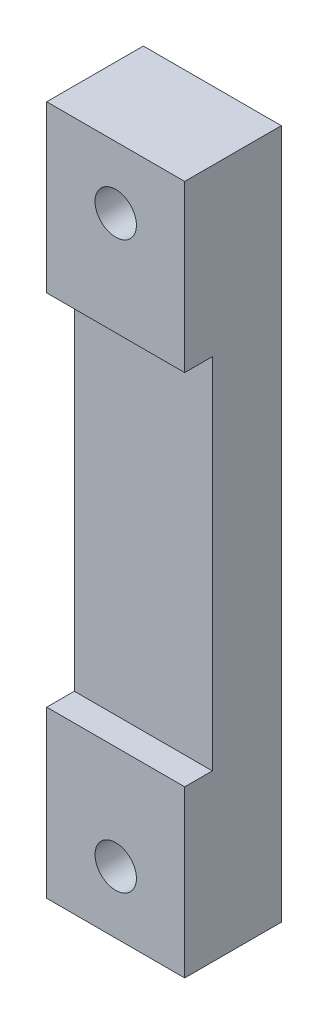
from build123d import *

# Parameters (mm, degrees)
ESQUISSE1_W             = 10
ESQUISSE1_H             = 50
BOSS_EXTRU_1_DEPTH      = 5
ESQUISSE4_W             = 10
ESQUISSE4_H             = 12
BOSS_EXTRU_2_DEPTH      = 2
ESQUISSE5_W             = 10
ESQUISSE5_H             = 12
BOSS_EXTRU_3_DEPTH      = 2
ESQUISSE7_R             = 1.5
ENL_V_MAT_EXTRU_2_DEPTH = 23.073899885
ESQUISSE8_R             = 1.5
ENL_V_MAT_EXTRU_3_DEPTH = 23.073899885


with BuildPart() as part:
    # Esquisse1 → Boss.-Extru.1 (new body)
    with BuildSketch(Plane.XY):
        with Locations((-18.961277556, 0.799561998)):
            Rectangle(ESQUISSE1_W, ESQUISSE1_H)
    extrude(amount=BOSS_EXTRU_1_DEPTH)

    # Esquisse4 → Boss.-Extru.2 (add)
    with BuildSketch(Plane.XY.offset(5)):
        with Locations((-18.961277556, 19.799561998)):
            Rectangle(ESQUISSE4_W, ESQUISSE4_H)
    extrude(amount=BOSS_EXTRU_2_DEPTH)

    # Esquisse5 → Boss.-Extru.3 (add)
    with BuildSketch(Plane.XY.offset(5)):
        with Locations((-18.961277556, -18.200438002)):
            Rectangle(ESQUISSE5_W, ESQUISSE5_H)
    extrude(amount=BOSS_EXTRU_3_DEPTH)

    # Esquisse7 → Enlèv. mat.-Extru.2 (cut)
    with BuildSketch(Plane.XY.offset(7)):
        with Locations((-18.961277556, -19.700438002)):
            Circle(ESQUISSE7_R)
    extrude(amount=-ENL_V_MAT_EXTRU_2_DEPTH, mode=Mode.SUBTRACT)

    # Esquisse8 → Enlèv. mat.-Extru.3 (cut)
    with BuildSketch(Plane.XY.offset(7)):
        with Locations((-18.961277556, 21.299561998)):
            Circle(ESQUISSE8_R)
    extrude(amount=-ENL_V_MAT_EXTRU_3_DEPTH, mode=Mode.SUBTRACT)


solid = part.part
